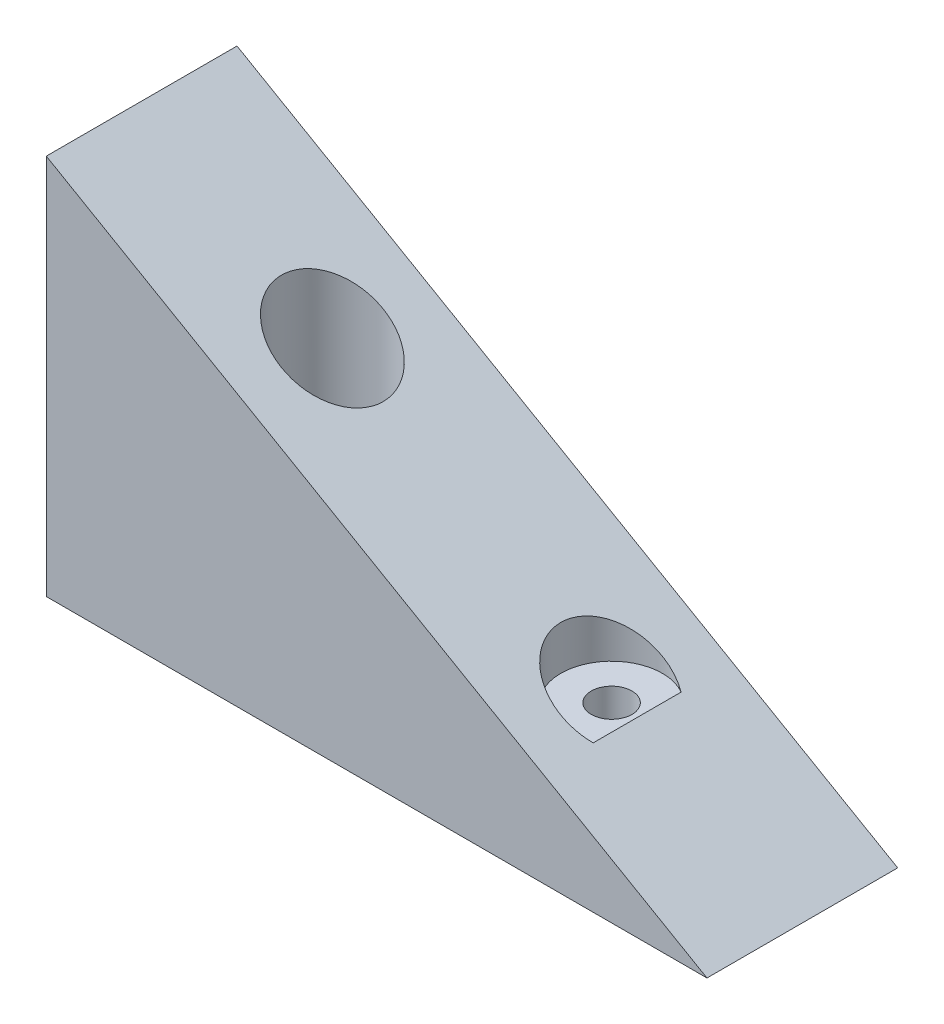
from build123d import *

# Parameters (mm, degrees)
EXTRUDE_1_DEPTH          = 15
SKETCH_2_R               = 1.6
CUT_EXTRUDE_1_DEPTH      = 43.426406871
CUT_EXTRUDE_2_DEPTH      = 34.541019662
CUT_EXTRUDE_2_DEPTH_BACK = 7.5
SKETCH_3_R               = 4
SKETCH_3_R_2             = 1.6


with BuildPart() as part:
    # ｽｹｯﾁ1 → ﾎﾞｽ - 押し出し1 (new body)
    with BuildSketch(Plane.XY):
        Polygon((-25.980762114, 15), (-25.980762114, -15), (25.980762114, -15), align=None)
    extrude(amount=EXTRUDE_1_DEPTH)

    # ｽｹｯﾁ2 → ｶｯﾄ - 押し出し1 (cut, through all)
    with BuildSketch(Plane.XZ.offset(15)):
        with Locations(Location((-10.980762114, 7.5, 0), (0, 0, 270))):
            Circle(SKETCH_2_R)
        with Locations(Location((10.980762114, 7.5, 0), (0, 0, 270))):
            Circle(SKETCH_2_R)
    extrude(amount=-CUT_EXTRUDE_1_DEPTH, mode=Mode.SUBTRACT)

    # ｽｹｯﾁ3 → ｶｯﾄ - 押し出し2 (cut, two sides: drawn at the far end of the back side and taken through both)
    # profile 1 of 2: a face of its own
    with BuildSketch(Plane(origin=(0, 0, 0), x_dir=(1, 0, 0), z_dir=(0, 1, 0)).offset(-CUT_EXTRUDE_2_DEPTH_BACK)):
        with Locations((-10.980762114, -7.5)):
            Circle(SKETCH_3_R)
        with Locations(Location((-10.980762114, -7.5, 0), (0, 0, 90))):
            Circle(SKETCH_3_R_2, mode=Mode.SUBTRACT)
    # profile 2 of 2: a face of its own
    with BuildSketch(Plane(origin=(0, 0, 0), x_dir=(1, 0, 0), z_dir=(0, 1, 0)).offset(-CUT_EXTRUDE_2_DEPTH_BACK)):
        with Locations((10.980762114, -7.5)):
            Circle(SKETCH_3_R)
        with Locations(Location((10.980762114, -7.5, 0), (0, 0, 90))):
            Circle(SKETCH_3_R_2, mode=Mode.SUBTRACT)
    extrude(amount=CUT_EXTRUDE_2_DEPTH + CUT_EXTRUDE_2_DEPTH_BACK, mode=Mode.SUBTRACT)


solid = part.part
